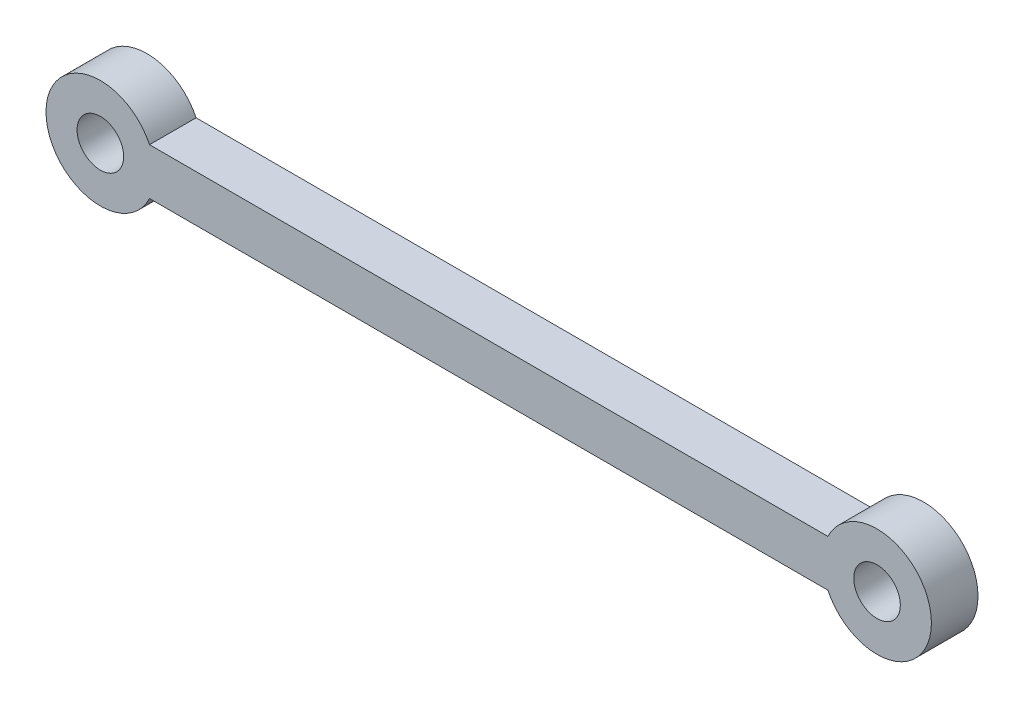
from build123d import *

# Parameters (mm, degrees)
SKETCH_1_R      = 1.5
EXTRUDE_1_DEPTH = 3


with BuildPart() as part:
    # 草图1 → 凸台-拉伸1 (new body)
    with BuildSketch(Plane.XY):
        with BuildLine():
            Line((3.16227766, 1.5), (46.83772234, 1.5))
            ThreePointArc((46.83772234, 1.5), (53.5, 0), (46.83772234, -1.5))
            Line((46.83772234, -1.5), (3.16227766, -1.5))
            ThreePointArc((3.16227766, -1.5), (-3.5, 0), (3.16227766, 1.5))
        make_face()
        Circle(SKETCH_1_R, mode=Mode.SUBTRACT)
        with Locations((50, 0)):
            Circle(SKETCH_1_R, mode=Mode.SUBTRACT)
    extrude(amount=EXTRUDE_1_DEPTH)


solid = part.part
